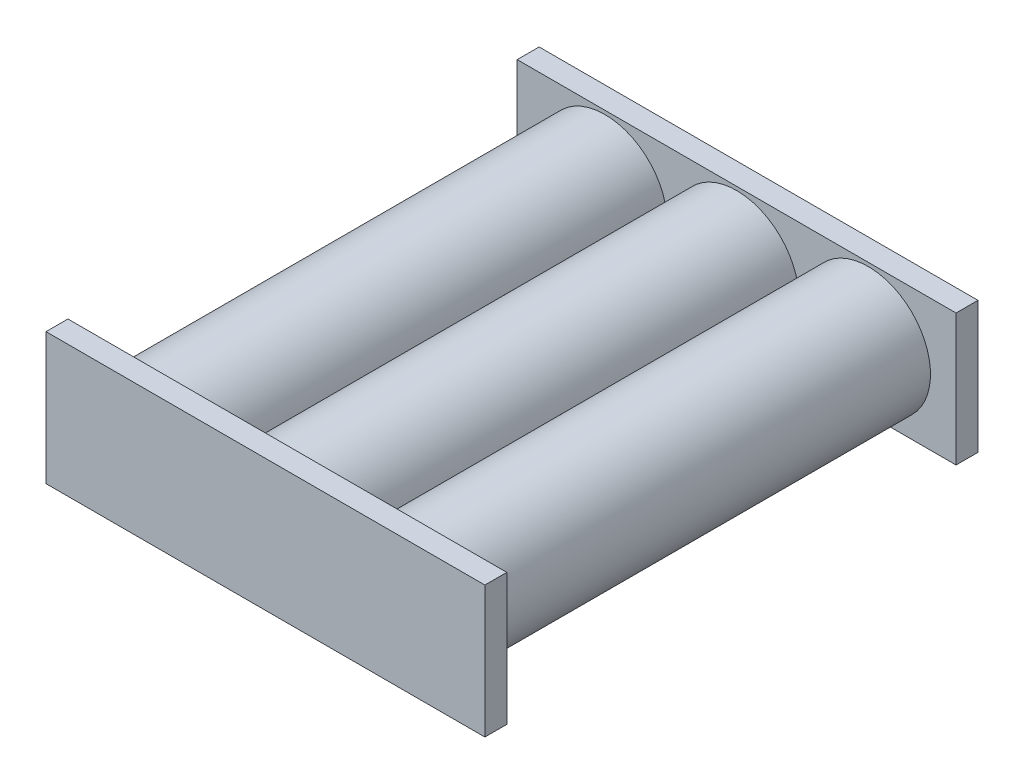
from build123d import *

# Parameters (mm, degrees)
SKETCH1_R           = 9
BOSS_EXTRUDE1_DEPTH = 65
LPATTERN1_COUNT     = 3
LPATTERN1_PITCH     = 19.05
SKETCH2_W           = 63.5
SKETCH2_H           = 19.05
BOSS_EXTRUDE5_DEPTH = 3.175
LPATTERN2_COUNT     = 2
LPATTERN2_PITCH     = 68.175


with BuildPart() as part:
    # Sketch1 → Boss-Extrude1 (new body)
    with BuildSketch(Plane.XY):
        Circle(SKETCH1_R)
    extrude(amount=BOSS_EXTRUDE1_DEPTH)


with BuildPart() as lpattern1_1:
    # LPattern1: pattern copy
    add(part.part.moved(Location(Vector(1, 0, 0) * (1 * LPATTERN1_PITCH))))


with BuildPart() as lpattern1_2:
    # LPattern1: pattern copy
    add(part.part.moved(Location(Vector(1, 0, 0) * (2 * LPATTERN1_PITCH))))


with BuildPart() as part_1:
    add(part.part)

    add(lpattern1_1.part)  # Boss-Extrude5 merges LPattern1_1

    add(lpattern1_2.part)  # Boss-Extrude5 merges LPattern1_2
    # Sketch2 → Boss-Extrude5 (add)
    with BuildSketch(Plane(origin=(0, 0, 0), x_dir=(-1, 0, 0), z_dir=(0, 0, -1))):
        with Locations((-19.05, 0)):
            Rectangle(SKETCH2_W, SKETCH2_H)
    boss_extrude5 = extrude(amount=BOSS_EXTRUDE5_DEPTH)

    # LPattern2: Boss-Extrude5 ×2
    with Locations(*[(0, 0, i * LPATTERN2_PITCH) for i in range(1, LPATTERN2_COUNT)]):
        add(boss_extrude5)


solid = part_1.part
